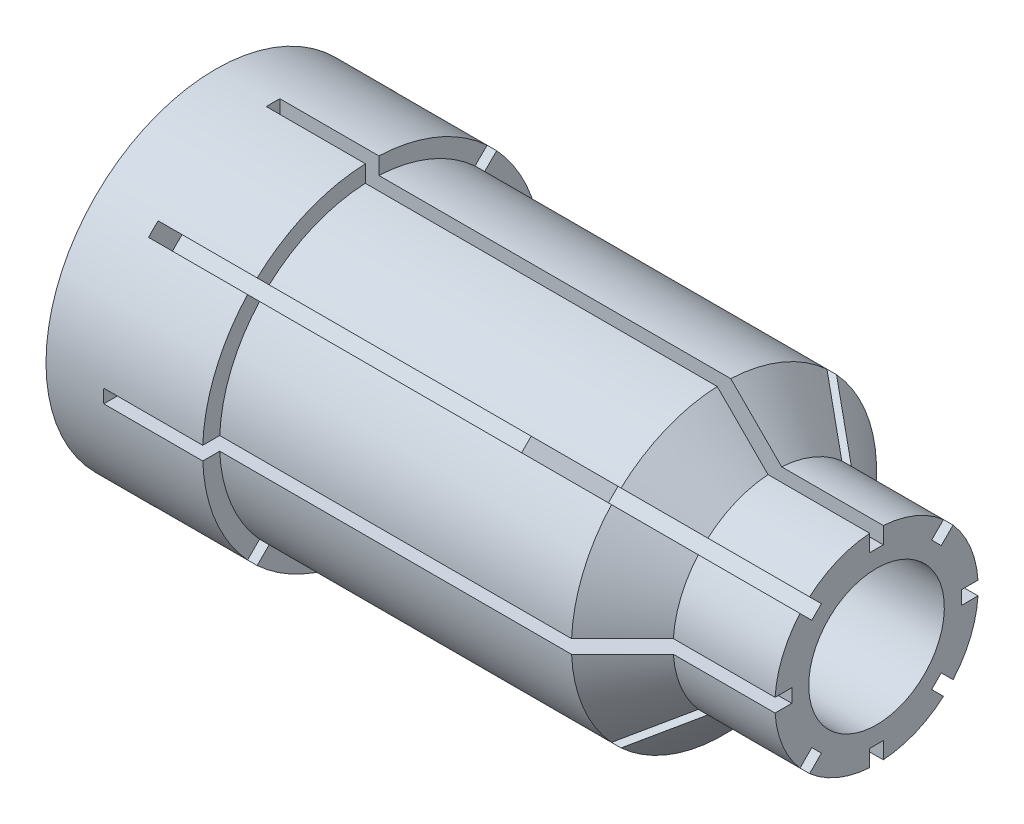
from build123d import *

# Parameters (mm, degrees)
CUT_EXTRUDE2_DEPTH = 0.2
CIRPATTERN2_COUNT  = 8
SKETCH4_W          = 0.4
SKETCH4_H          = 0.75
CUT_EXTRUDE3_DEPTH = 1
CIRPATTERN3_COUNT  = 8


with BuildPart() as part:
    # Sketch1 → Revolve1 (revolve)
    with BuildSketch(Plane.XY):
        Polygon((-10, 3), (-10, 2), (-16, 2), (-17.5, 3.5), (-29.5, 3.5), (-29.5, 5), (-24.88, 5), (-24.88, 4.5), (-14.5, 4.5), (-13, 3), align=None)
    revolve(axis=Axis((0, 0, 0), (-1, 0, 0)))

    # Sketch3 → Cut-Extrude2 (cut, symmetric)
    with BuildSketch(Plane.XY):
        Polygon((-14.5, 4.5), (-13, 3), (-10, 3), (-10, 2.5), (-16, 2.5), (-17.5, 4), (-27.8, 4), (-27.8, 5.5), (-24.88457259, 5.5), (-24.88457259, 4.5), align=None)
    cut_extrude2 = extrude(amount=CUT_EXTRUDE2_DEPTH, both=True, mode=Mode.SUBTRACT)

    # CirPattern2: Cut-Extrude2 ×8 about axis
    cirpattern2_axis = Axis((-10, 0, 0), (1, 0, 0))
    for i in range(1, CIRPATTERN2_COUNT):
        add(cut_extrude2.rotate(cirpattern2_axis, i * 360 / CIRPATTERN2_COUNT), mode=Mode.SUBTRACT)

    # Sketch4 → Cut-Extrude3 (cut)
    with BuildSketch(Plane(origin=(-24.88, 0, 0), x_dir=(0, 0, -1), z_dir=(1, 0, 0))):
        with Locations((0, 4.872999199)):
            Rectangle(SKETCH4_W, SKETCH4_H)
    cut_extrude3 = extrude(amount=-CUT_EXTRUDE3_DEPTH, mode=Mode.SUBTRACT)

    # CirPattern3: Cut-Extrude3 ×8 about axis
    cirpattern3_axis = Axis((-24.88, 0, 0), (1, 0, 0))
    for i in range(1, CIRPATTERN3_COUNT):
        add(cut_extrude3.rotate(cirpattern3_axis, i * 360 / CIRPATTERN3_COUNT), mode=Mode.SUBTRACT)


solid = part.part
